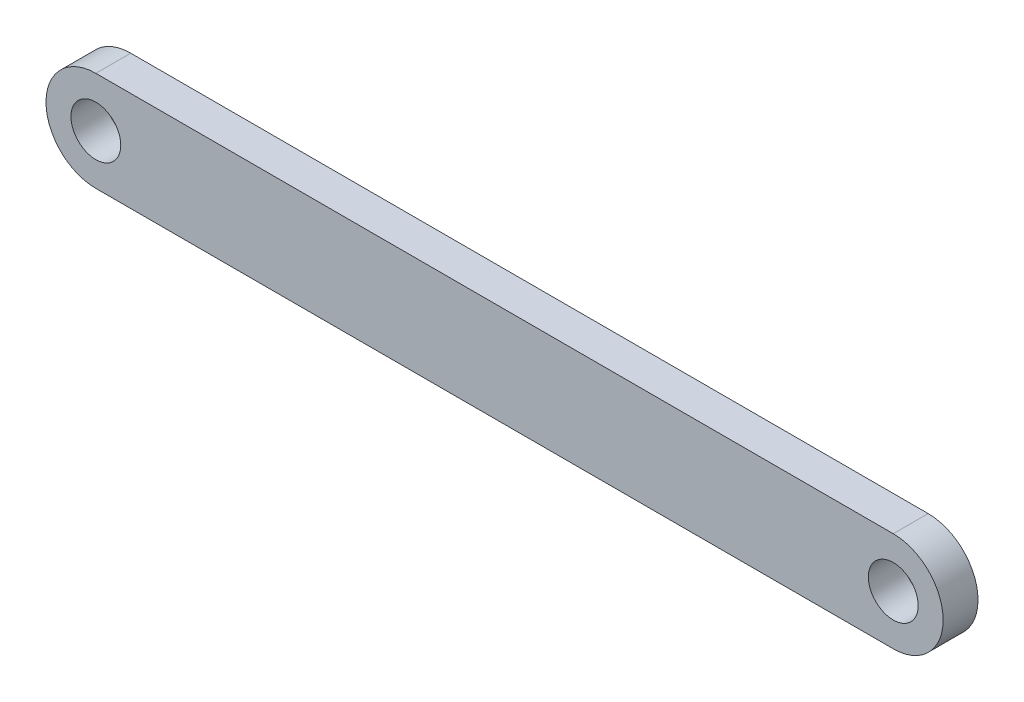
from build123d import *

# Parameters (mm, degrees)
SKETCH_1_R      = 5
EXTRUDE_1_DEPTH = 7


with BuildPart() as part:
    # 草图1 → 凸台-拉伸1 (new body)
    with BuildSketch(Plane.XY):
        with BuildLine():
            Line((0, 10), (160, 10))
            ThreePointArc((160, 10), (170, 0), (160, -10))
            Line((160, -10), (0, -10))
            ThreePointArc((0, -10), (-10, 0), (0, 10))
        make_face()
        Circle(SKETCH_1_R, mode=Mode.SUBTRACT)
        with Locations((160, 0)):
            Circle(SKETCH_1_R, mode=Mode.SUBTRACT)
    extrude(amount=EXTRUDE_1_DEPTH)


solid = part.part
